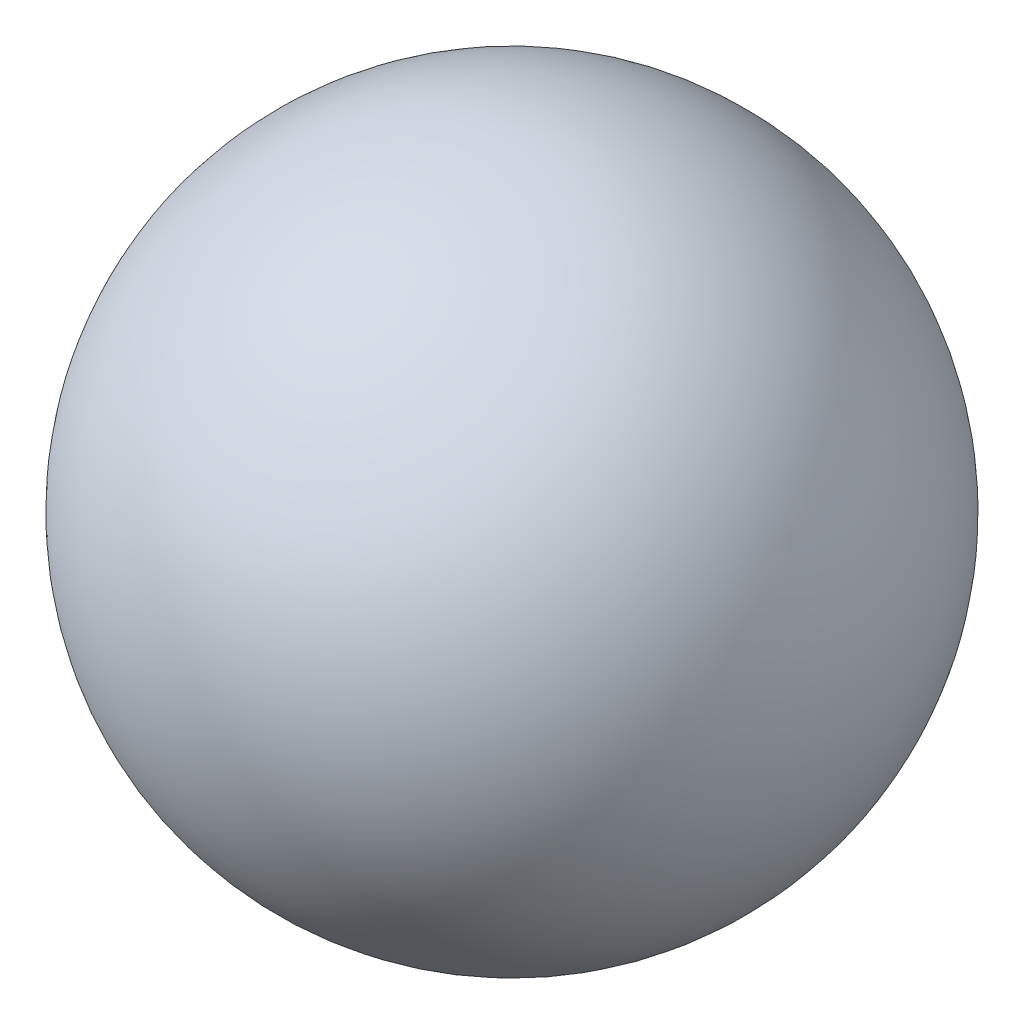
from build123d import *


with BuildPart() as part:
    # Croquis1 → Revolución1 (revolve)
    with BuildSketch(Plane.XY):
        with BuildLine():
            Line((-9.5, 0), (9.5, 0))
            ThreePointArc((9.5, 0), (0, -9.5), (-9.5, 0))
        make_face()
    revolve(axis=Axis((-9.5, 0, 0), (1, 0, 0)))


solid = part.part
